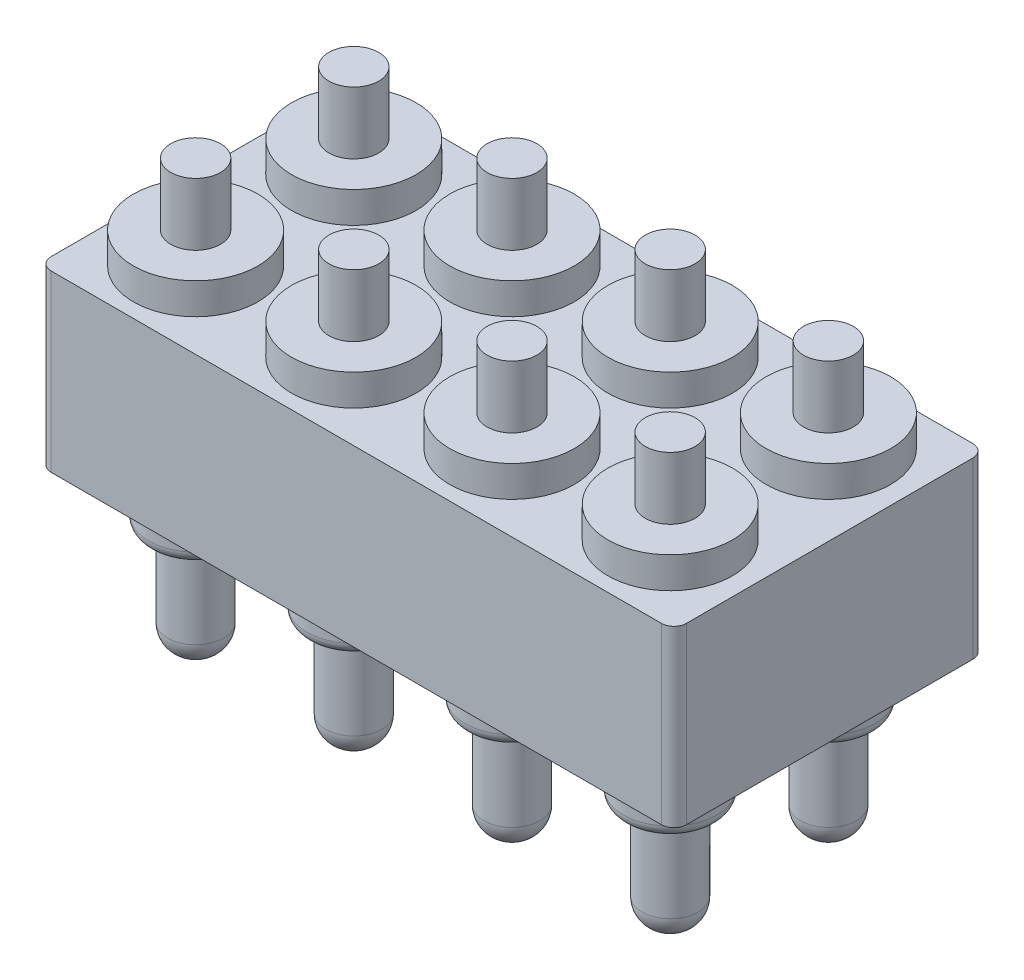
from build123d import *

# Parameters (mm, degrees)
SKETCH_1_W      = 10.2
SKETCH_1_H      = 5
EXTRUDE_1_DEPTH = 2.8
SKETCH_2_R      = 0.75
EXTRUDE_2_DEPTH = 3.65
SKETCH_3_R      = 1
EXTRUDE_3_DEPTH = 0.5
SKETCH_4_R      = 0.4
EXTRUDE_4_DEPTH = 1
SKETCH_5_R      = 0.45
EXTRUDE_5_DEPTH = 1.7
FILLET_1_R      = 0.2
FILLET_2_R      = 0.4
FILLET_3_R      = 0.2


with BuildPart() as part:
    # 草图1 → 凸台-拉伸1 (new body)
    with BuildSketch(Plane(origin=(0, 0, 0), x_dir=(1, 0, 0), z_dir=(0, 1, 0))):
        with Locations((5.1, 2.5)):
            Rectangle(SKETCH_1_W, SKETCH_1_H)
    extrude(amount=EXTRUDE_1_DEPTH)

    # 草图2 → 凸台-拉伸2 (add)
    with BuildSketch(Plane(origin=(0, 2.8, 0), x_dir=(1, 0, 0), z_dir=(0, 1, 0))):
        with Locations(Location((1.29, 3.77, 0), (0, 0, 270))):
            Circle(SKETCH_2_R)
        with Locations(Location((3.83, 3.77, 0), (0, 0, 270))):
            Circle(SKETCH_2_R)
        with Locations(Location((6.37, 3.77, 0), (0, 0, 270))):
            Circle(SKETCH_2_R)
        with Locations(Location((8.91, 3.77, 0), (0, 0, 270))):
            Circle(SKETCH_2_R)
        with Locations(Location((3.83, 1.23, 0), (0, 0, 270))):
            Circle(SKETCH_2_R)
        with Locations(Location((6.37, 1.23, 0), (0, 0, 270))):
            Circle(SKETCH_2_R)
        with Locations(Location((8.91, 1.23, 0), (0, 0, 270))):
            Circle(SKETCH_2_R)
        with Locations(Location((1.29, 1.23, 0), (0, 0, 270))):
            Circle(SKETCH_2_R)
    extrude(amount=-EXTRUDE_2_DEPTH)

    # 草图3 → 凸台-拉伸3 (add)
    with BuildSketch(Plane(origin=(0, 2.8, 0), x_dir=(1, 0, 0), z_dir=(0, 1, 0))):
        with Locations(Location((1.29, 3.77, 0), (0, 0, 90))):
            Circle(SKETCH_3_R)
        with Locations(Location((3.83, 3.77, 0), (0, 0, 90))):
            Circle(SKETCH_3_R)
        with Locations(Location((6.37, 3.77, 0), (0, 0, 90))):
            Circle(SKETCH_3_R)
        with Locations(Location((8.91, 3.77, 0), (0, 0, 90))):
            Circle(SKETCH_3_R)
        with Locations(Location((3.83, 1.23, 0), (0, 0, 90))):
            Circle(SKETCH_3_R)
        with Locations(Location((6.37, 1.23, 0), (0, 0, 90))):
            Circle(SKETCH_3_R)
        with Locations(Location((8.91, 1.23, 0), (0, 0, 90))):
            Circle(SKETCH_3_R)
        with Locations(Location((1.29, 1.23, 0), (0, 0, 90))):
            Circle(SKETCH_3_R)
    extrude(amount=EXTRUDE_3_DEPTH)

    # 草图4 → 凸台-拉伸4 (add)
    with BuildSketch(Plane(origin=(0, 3.3, 0), x_dir=(1, 0, 0), z_dir=(0, 1, 0))):
        with Locations(Location((1.29, 1.23, 0), (0, 0, 270))):
            Circle(SKETCH_4_R)
        with Locations(Location((3.83, 1.23, 0), (0, 0, 270))):
            Circle(SKETCH_4_R)
        with Locations(Location((6.37, 1.23, 0), (0, 0, 270))):
            Circle(SKETCH_4_R)
        with Locations(Location((8.91, 1.23, 0), (0, 0, 270))):
            Circle(SKETCH_4_R)
        with Locations(Location((3.83, 3.77, 0), (0, 0, 270))):
            Circle(SKETCH_4_R)
        with Locations(Location((6.37, 3.77, 0), (0, 0, 270))):
            Circle(SKETCH_4_R)
        with Locations(Location((8.91, 3.77, 0), (0, 0, 270))):
            Circle(SKETCH_4_R)
        with Locations(Location((1.29, 3.77, 0), (0, 0, 270))):
            Circle(SKETCH_4_R)
    extrude(amount=EXTRUDE_4_DEPTH)

    # 草图5 → 凸台-拉伸5 (add)
    with BuildSketch(Plane.XZ.offset(0.85)):
        with Locations(Location((1.29, -3.77, 0), (0, 0, 270))):
            Circle(SKETCH_5_R)
        with Locations(Location((3.83, -3.77, 0), (0, 0, 270))):
            Circle(SKETCH_5_R)
        with Locations(Location((6.37, -3.77, 0), (0, 0, 270))):
            Circle(SKETCH_5_R)
        with Locations(Location((8.91, -3.77, 0), (0, 0, 270))):
            Circle(SKETCH_5_R)
        with Locations(Location((3.83, -1.23, 0), (0, 0, 270))):
            Circle(SKETCH_5_R)
        with Locations(Location((6.37, -1.23, 0), (0, 0, 270))):
            Circle(SKETCH_5_R)
        with Locations(Location((8.91, -1.23, 0), (0, 0, 270))):
            Circle(SKETCH_5_R)
        with Locations(Location((1.29, -1.23, 0), (0, 0, 270))):
            Circle(SKETCH_5_R)
    extrude(amount=EXTRUDE_5_DEPTH)

    # 圆角1
    fillet_1_edges = [part.edges().sort_by_distance(p)[0] for p in [
        (1.29, -0.85, -4.52),
        (3.83, -0.85, -4.52),
        (6.37, -0.85, -4.52),
        (8.91, -0.85, -4.52),
        (3.83, -0.85, -1.98),
        (6.37, -0.85, -1.98),
        (8.91, -0.85, -1.98),
        (1.29, -0.85, -1.98),
    ]]
    fillet(fillet_1_edges, radius=FILLET_1_R)

    # 圆角2
    fillet_2_edges = [part.edges().sort_by_distance(p)[0] for p in [
        (1.29, -2.55, -3.32),
        (3.83, -2.55, -3.32),
        (6.37, -2.55, -3.32),
        (8.91, -2.55, -3.32),
        (3.83, -2.55, -0.78),
        (6.37, -2.55, -0.78),
        (8.91, -2.55, -0.78),
        (1.29, -2.55, -0.78),
    ]]
    fillet(fillet_2_edges, radius=FILLET_2_R)

    # 圆角3
    fillet_3_edges = [part.edges().sort_by_distance(p)[0] for p in [
        (0, 1.4, -5),
        (10.2, 1.4, -5),
        (10.2, 1.4, 0),
        (0, 1.4, 0),
    ]]
    fillet(fillet_3_edges, radius=FILLET_3_R)


solid = part.part
